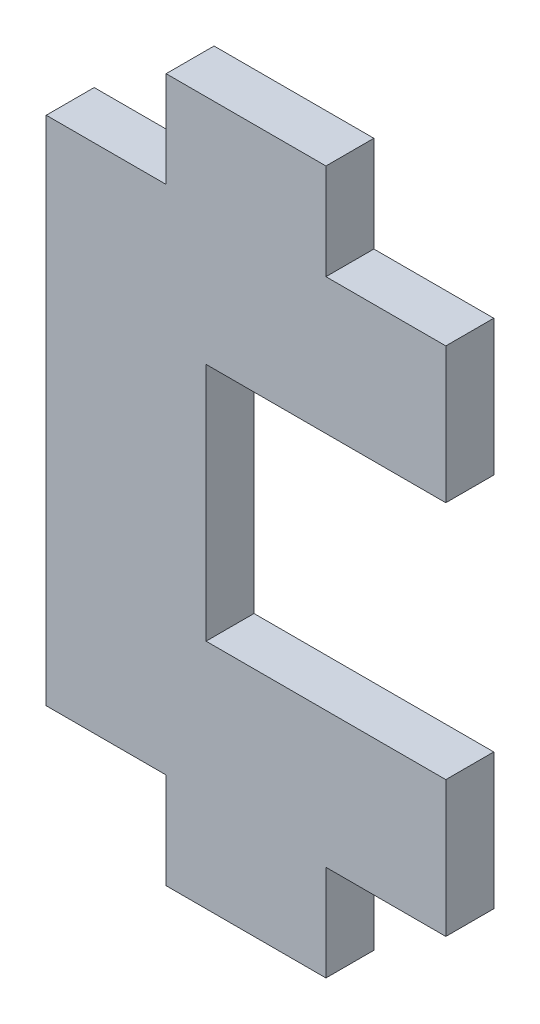
from build123d import *

# Parameters (mm, degrees)
ESBO_O1_W                = 10
ESBO_O1_H                = 6
RESSALTO_EXTRUS_O1_DEPTH = 3


with BuildPart() as part:
    # Esboço1 → Ressalto-extrusão1 (new body)
    with BuildSketch(Plane.XY):
        Polygon((-12.5, 16), (-12.5, -16), (-5, -16), (5, -16), (12.5, -16), (12.5, -7.5), (-2.5, -7.5), (-2.5, 7.5), (12.5, 7.5), (12.5, 16), (5, 16), (-5, 16), align=None)
        with Locations((0, 19)):
            Rectangle(ESBO_O1_W, ESBO_O1_H)
        with Locations((0, -19)):
            Rectangle(ESBO_O1_W, ESBO_O1_H)
    extrude(amount=RESSALTO_EXTRUS_O1_DEPTH)


solid = part.part
